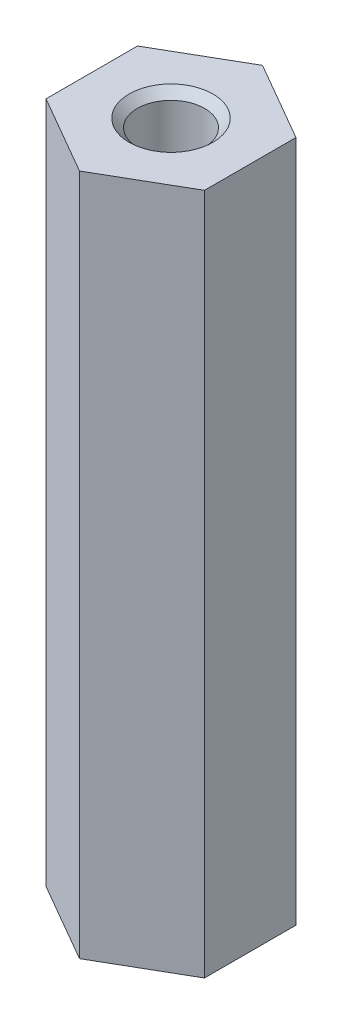
from build123d import *

# Parameters (mm, degrees)
BOSS_EXTRUDE1_DEPTH        = 41
F_10_32_TAPPED_HOLE1_D     = 4.0386
F_10_32_TAPPED_HOLE1_DEPTH = 8
F_10_32_TAPPED_HOLE1_TIP   = 1.213317848
F_10_32_TAPPED_HOLE2_D     = 4.0386
F_10_32_TAPPED_HOLE2_DEPTH = 8
F_10_32_TAPPED_HOLE2_TIP   = 1.213317848
CHAMFER1_SIZE              = 0.5


with BuildPart() as part:
    # Sketch1 → Boss-Extrude1 (new body)
    with BuildSketch(Plane(origin=(0, 0, 0), x_dir=(1, 0, 0), z_dir=(0, 1, 0))):
        Polygon((0, -5.499261314), (4.7625, -2.749630657), (4.7625, 2.749630657), (0, 5.499261314), (-4.7625, 2.749630657), (-4.7625, -2.749630657), align=None)
    extrude(amount=BOSS_EXTRUDE1_DEPTH)

    # #10-32 Tapped Hole1
    with Locations(Plane(origin=(0, 41, 0), x_dir=(1, 0, 0), z_dir=(0, 1, 0))):
        with Locations((0, 0)):
            Hole(F_10_32_TAPPED_HOLE1_D / 2, depth=F_10_32_TAPPED_HOLE1_DEPTH)
            with Locations((0, 0, -(F_10_32_TAPPED_HOLE1_DEPTH + F_10_32_TAPPED_HOLE1_TIP / 2))):  # 118° drill point
                Cone(0, F_10_32_TAPPED_HOLE1_D / 2, F_10_32_TAPPED_HOLE1_TIP, mode=Mode.SUBTRACT)

    # #10-32 Tapped Hole2
    with Locations(Plane(origin=(0, 0, 0), x_dir=(-1, 0, 0), z_dir=(0, -1, 0))):
        with Locations((0, 0)):
            Hole(F_10_32_TAPPED_HOLE2_D / 2, depth=F_10_32_TAPPED_HOLE2_DEPTH)
            with Locations((0, 0, -(F_10_32_TAPPED_HOLE2_DEPTH + F_10_32_TAPPED_HOLE2_TIP / 2))):  # 118° drill point
                Cone(0, F_10_32_TAPPED_HOLE2_D / 2, F_10_32_TAPPED_HOLE2_TIP, mode=Mode.SUBTRACT)

    # Chamfer1
    chamfer1_edges = [part.edges().sort_by_distance(p)[0] for p in [
        (2.0193, 41, 0),
        (-2.0193, 0, 0),
    ]]
    chamfer(chamfer1_edges, length=CHAMFER1_SIZE)


solid = part.part
